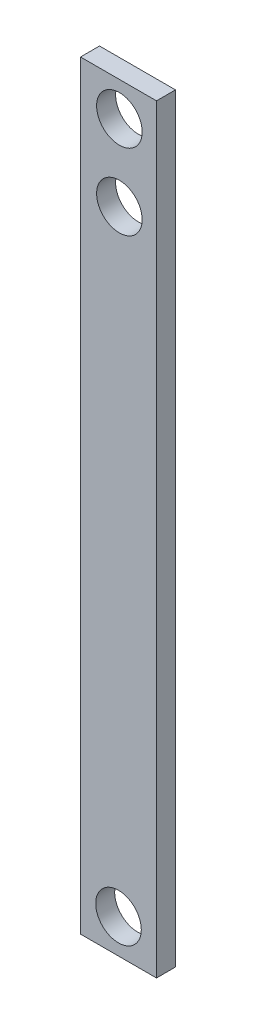
from build123d import *

# Parameters (mm, degrees)
SKETCH1_W           = 10
SKETCH1_H           = 100
BOSS_EXTRUDE1_DEPTH = 2.5
SKETCH2_R           = 3
CUT_EXTRUDE1_DEPTH  = 101.529846314
SKETCH5_R           = 3
CUT_EXTRUDE2_DEPTH  = 101.529846314
SKETCH3_R           = 3
CUT_EXTRUDE3_DEPTH  = 10


with BuildPart() as part:
    # Sketch1 → Boss-Extrude1 (new body)
    with BuildSketch(Plane.XY):
        with Locations((5, 50)):
            Rectangle(SKETCH1_W, SKETCH1_H)
    extrude(amount=BOSS_EXTRUDE1_DEPTH)

    # Sketch2 → Cut-Extrude1 (cut, through all)
    with BuildSketch(Plane.XY.offset(2.5)):
        with Locations((5, 4.5)):
            Circle(SKETCH2_R)
    extrude(amount=-CUT_EXTRUDE1_DEPTH, mode=Mode.SUBTRACT)

    # Sketch5 → Cut-Extrude2 (cut, through all)
    with BuildSketch(Plane.XY.offset(2.5)):
        with Locations((5.115048416, 85.5)):
            Circle(SKETCH5_R)
    extrude(amount=-CUT_EXTRUDE2_DEPTH, mode=Mode.SUBTRACT)

    # Sketch3 → Cut-Extrude3 (cut)
    with BuildSketch(Plane.XY.offset(2.5)):
        with Locations((5.115048416, 95.5)):
            Circle(SKETCH3_R)
    extrude(amount=-CUT_EXTRUDE3_DEPTH, mode=Mode.SUBTRACT)


solid = part.part
